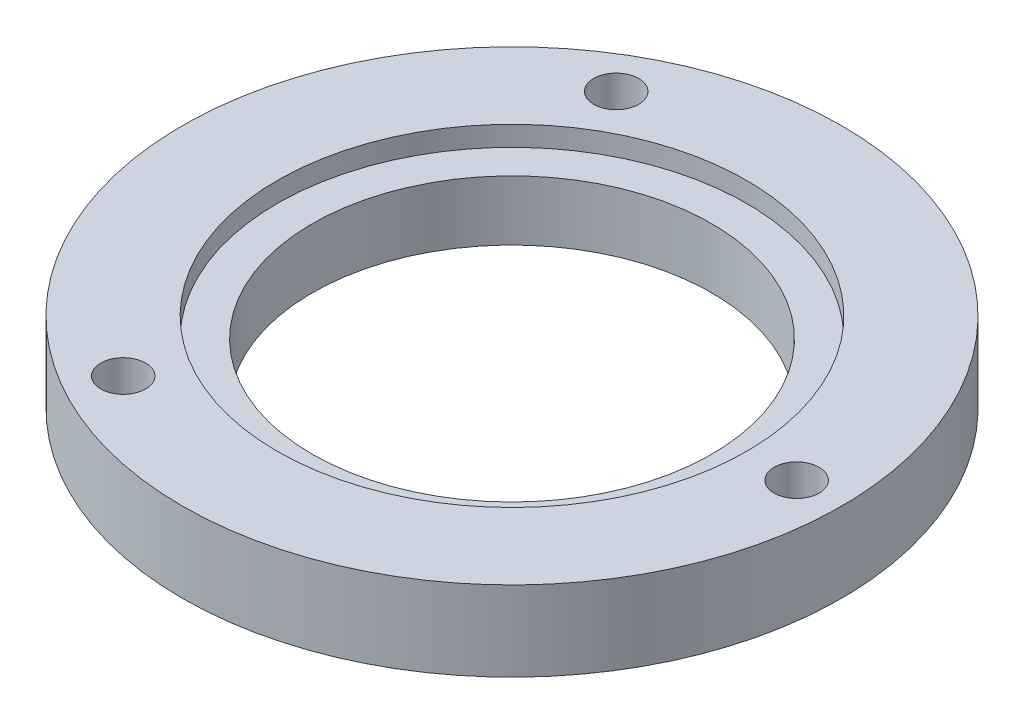
from build123d import *

# Parameters (mm, degrees)
CHAMBRAGE_POUR_VIS_T_TE_CYLINDRIQUE_D           = 4.5
CHAMBRAGE_POUR_VIS_T_TE_CYLINDRIQUE_CBORE_D     = 8
CHAMBRAGE_POUR_VIS_T_TE_CYLINDRIQUE_CBORE_DEPTH = 4
R_P_TITION_CIRCULAIRE1_COUNT                    = 3


with BuildPart() as part:
    # Esquisse1 → Révolution1 (revolve)
    with BuildSketch(Plane.XY, mode=Mode.PRIVATE) as r_volution1_sk:
        Polygon((20, 6), (20, 0), (33, 0), (33, 8), (23.5, 8), (23.5, 6), align=None)
    revolve(r_volution1_sk.sketch.rotate(Axis((0, 31.17754591, 0), (0, -1, 0)), 90), axis=Axis((0, 31.17754591, 0), (0, -1, 0)))

    # Chambrage pour vis à tête cylindrique à 6 pans creux (ou vis CHC) M41 (through all)
    with Locations(Plane.XZ):
        with Locations((28.5, 0)):
            chambrage_pour_vis_t_te_cylindrique = CounterBoreHole(CHAMBRAGE_POUR_VIS_T_TE_CYLINDRIQUE_D / 2, CHAMBRAGE_POUR_VIS_T_TE_CYLINDRIQUE_CBORE_D / 2, CHAMBRAGE_POUR_VIS_T_TE_CYLINDRIQUE_CBORE_DEPTH)

    # Répétition circulaire1: Chambrage pour vis à tête cylindrique à 6 pans creux (ou vis CHC) M41 ×3 about axis
    r_p_tition_circulaire1_axis = Axis((0, 0, 0), (0, 1, 0))
    for i in range(1, R_P_TITION_CIRCULAIRE1_COUNT):
        add(chambrage_pour_vis_t_te_cylindrique.rotate(r_p_tition_circulaire1_axis, i * 360 / R_P_TITION_CIRCULAIRE1_COUNT), mode=Mode.SUBTRACT)


solid = part.part
